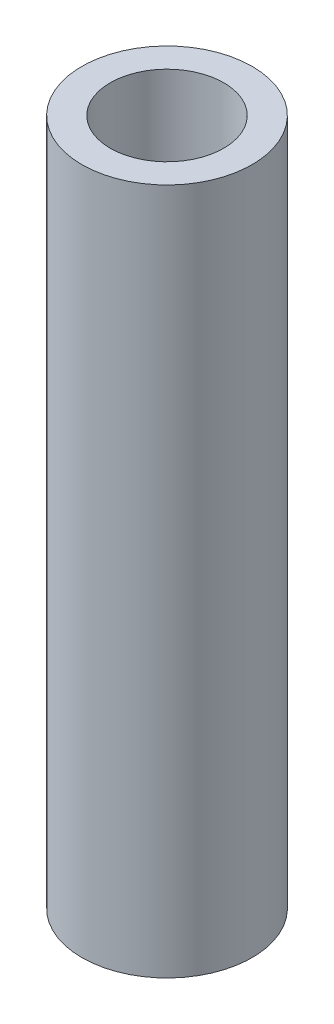
from build123d import *

# Parameters (mm, degrees)
SKETCH_1_R      = 7.5
SKETCH_1_R_2    = 5
EXTRUDE_1_DEPTH = 60.5


with BuildPart() as part:
    # 草图1 → 凸台-拉伸1 (new body)
    with BuildSketch(Plane(origin=(0, 0, 0), x_dir=(1, 0, 0), z_dir=(0, 1, 0))):
        with Locations(Location((0, 0, 0), (0, 0, 270))):
            Circle(SKETCH_1_R)
        with Locations(Location((0, 0, 0), (0, 0, 270))):
            Circle(SKETCH_1_R_2, mode=Mode.SUBTRACT)
    extrude(amount=EXTRUDE_1_DEPTH)


solid = part.part
